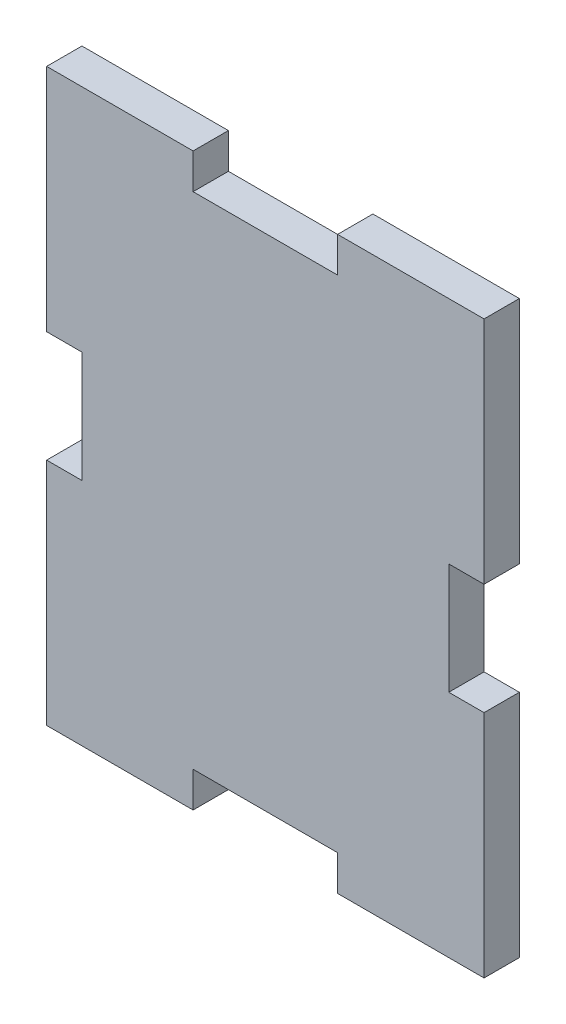
from build123d import *

# Parameters (mm, degrees)
BOSS_EXTRUDE1_DEPTH = 6.35


with BuildPart() as part:
    # Sketch1 → Boss-Extrude1 (new body)
    with BuildSketch(Plane.XY):
        Polygon((0, 0), (0, 41.35), (6.35, 41.35), (6.35, 61.35), (0, 61.35), (0, 102.7), (26.35, 102.7), (26.35, 96.35), (52.35, 96.35), (52.35, 102.7), (78.7, 102.7), (78.7, 61.35), (72.35, 61.35), (72.35, 41.35), (78.7, 41.35), (78.7, 0), (52.35, 0), (52.35, 6.35), (26.35, 6.35), (26.35, 0), align=None)
    extrude(amount=BOSS_EXTRUDE1_DEPTH)


solid = part.part
